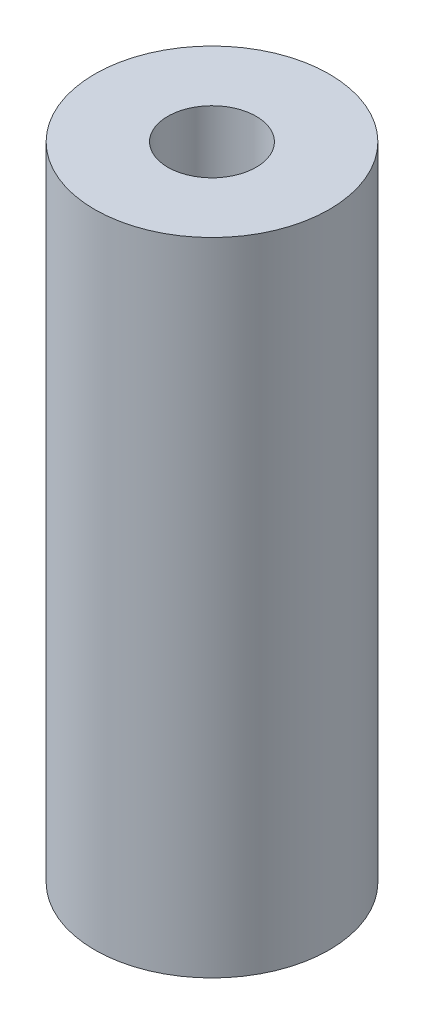
from build123d import *

# Parameters (mm, degrees)
SKETCH1_R             = 3
BOSS_EXTRUDE1_DEPTH   = 16.4
F_4_40_TAPPED_HOLE1_D = 2.2606


with BuildPart() as part:
    # Sketch1 → Boss-Extrude1 (new body)
    with BuildSketch(Plane(origin=(0, 0, 0), x_dir=(1, 0, 0), z_dir=(0, 1, 0))):
        with Locations(Location((0, 0, 0), (0, 0, 270))):
            Circle(SKETCH1_R)
    extrude(amount=BOSS_EXTRUDE1_DEPTH)

    # #4-40 Tapped Hole1 (through all)
    with Locations(Plane(origin=(0, 16.4, 0), x_dir=(1, 0, 0), z_dir=(0, 1, 0))):
        with Locations((0, 0)):
            Hole(F_4_40_TAPPED_HOLE1_D / 2)


solid = part.part
